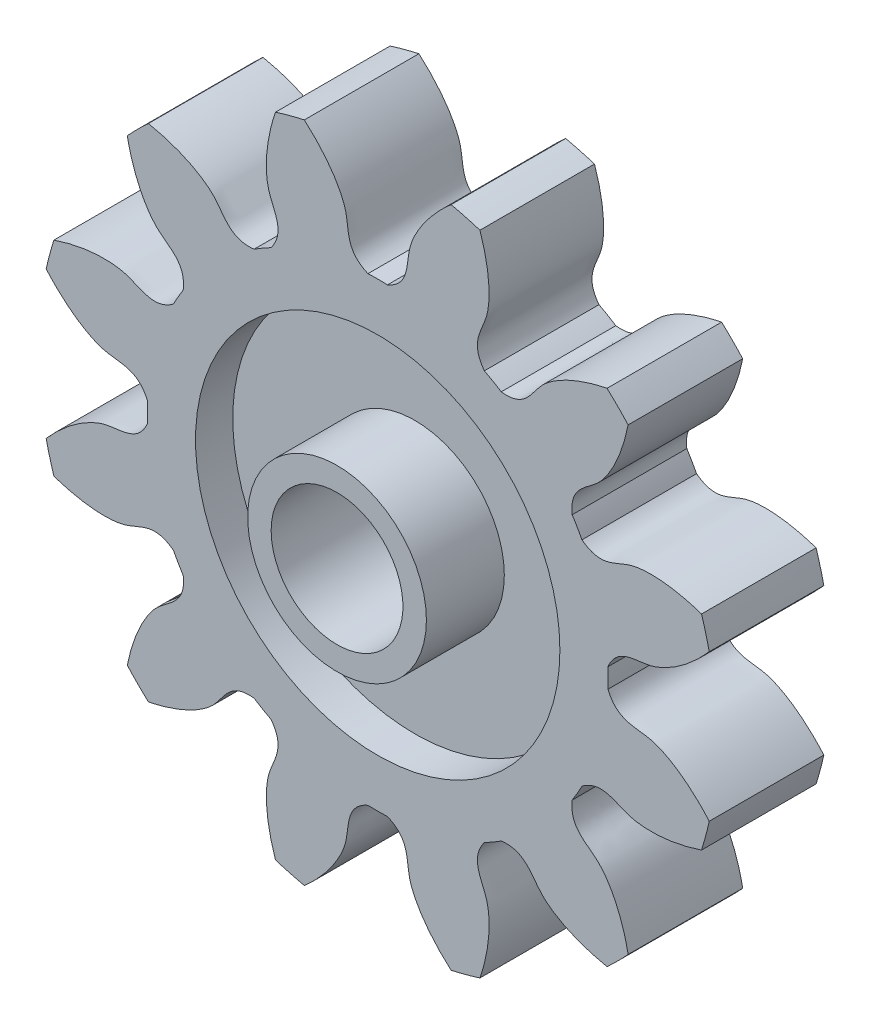
from build123d import *

# Parameters (mm, degrees)
SKETCH_1_R               = 11.853333339
EXTRUDE_1_DEPTH          = 4
CUT_EXTRUDE_1_DEPTH      = 18.233775631
PATTERN_CIRCULAR_1_COUNT = 12
SKETCH_4_R               = 6.36
CUT_EXTRUDE_2_DEPTH      = 1.3
CUT_EXTRUDE_START        = -1.3
SKETCH_5_R               = 6.36
CUT_EXTRUDE_3_DEPTH      = 1.3
SKETCH_6_R               = 3.12
EXTRUDE_2_DEPTH          = 2.72
EXTRUDE_START            = 2.72
SKETCH_7_R               = 3.12
EXTRUDE_3_DEPTH          = 2.72
SKETCH_8_R               = 2.3
CUT_EXTRUDE_4_DEPTH      = 18.738812012


with BuildPart() as part:
    # 草图1 → 凸台-拉伸1 (new body)
    with BuildSketch(Plane.XY):
        Circle(SKETCH_1_R)
    extrude(amount=EXTRUDE_1_DEPTH)

    # 草图2 → 切除-拉伸1 (cut, through all)
    with BuildSketch(Plane.XY):
        with BuildLine():
            ThreePointArc((0.340089257, 8.036140266), (0, 8.043333332), (-0.340089257, 8.036140266))
            add(Edge.make_bspline(
                [(-0.340089257, 8.036140266), (-1.152802485, 8.380827302), (-0.972605757, 9.050559634), (-1.144951038, 9.63418711), (-1.155909726, 9.668773713), (-1.168784811, 9.706751265), (-1.183712591, 9.748056173), (-1.200831778, 9.792619882), (-1.220277833, 9.840369901), (-1.242184563, 9.891229553), (-1.26668349, 9.945118118), (-1.293903901, 10.001950868), (-1.323972693, 10.061639127), (-1.357014279, 10.124090335), (-1.393150483, 10.189208114), (-1.432500435, 10.25689233), (-1.475180474, 10.327039167), (-1.521304041, 10.399541199), (-1.570981591, 10.474287463), (-1.62432049, 10.551163535), (-1.681424925, 10.630051615), (-1.74239581, 10.710830603), (-1.807330697, 10.793376185), (-1.876323688, 10.877560923), (-1.94946535, 10.963254337), (-2.026842632, 11.050323004), (-2.108538779, 11.138630643), (-2.194633261, 11.228038218), (-2.28520169, 11.318404026), (-2.380315749, 11.409583805), (-2.480043117, 11.501430831), (-2.584447403, 11.593796018), (-2.693588078, 11.686528027), (-2.807520411, 11.779473372), (-2.926295405, 11.872476524), (-3.049959741, 11.965380024), (-3.178555721, 12.058024596), (-3.312121213, 12.150249252), (-3.450689601, 12.241891415), (-3.594289737, 12.332787027), (-3.742945897, 12.422770671), (-3.896677735, 12.511675685), (-4.055500247, 12.599334283), (-4.219423733, 12.685577674), (-4.388453763, 12.770236183), (-4.562591149, 12.853139375), (-4.741831913, 12.934116174), (-4.926167263, 13.012994989), (-5.115583581, 13.08960384), (-5.31006237, 13.163770481), (-5.578482967, 13.260032674), (-5.783738495, 13.326705048), (-5.922611814, 13.368817405)],
                knots=[0, 0, 0, 0, 0.218015236, 0.222043642, 0.226545979, 0.231522246, 0.236972443, 0.24289657, 0.249294627, 0.256166614, 0.263512532, 0.271332379, 0.279626157, 0.288393865, 0.297635503, 0.307351072, 0.31754057, 0.328203999, 0.339341357, 0.350952646, 0.363037866, 0.375597015, 0.388630094, 0.402137104, 0.416118043, 0.430572913, 0.445501713, 0.460904444, 0.476781104, 0.493131694, 0.509956215, 0.527254666, 0.545027047, 0.563273358, 0.581993599, 0.601187771, 0.620855872, 0.640997904, 0.661613866, 0.682703758, 0.704267581, 0.726305333, 0.748817015, 0.771802628, 0.795262171, 0.819195644, 0.843603047, 0.868484381, 0.893839644, 0.919668838, 0.945971962, 1, 1, 1, 1], degree=3))
            ThreePointArc((-5.922611814, 13.368817405), (0, 14.621990614), (5.922611814, 13.368817405))
            add(Edge.make_bspline(
                [(0.340089257, 8.036140266), (1.152802485, 8.380827302), (0.972605757, 9.050559634), (1.144951038, 9.63418711), (1.155909726, 9.668773713), (1.168784811, 9.706751265), (1.183712591, 9.748056173), (1.200831778, 9.792619882), (1.220277833, 9.840369901), (1.242184563, 9.891229553), (1.26668349, 9.945118118), (1.293903901, 10.001950868), (1.323972693, 10.061639127), (1.357014279, 10.124090335), (1.393150483, 10.189208114), (1.432500435, 10.25689233), (1.475180474, 10.327039167), (1.521304041, 10.399541199), (1.570981591, 10.474287463), (1.62432049, 10.551163535), (1.681424925, 10.630051615), (1.74239581, 10.710830603), (1.807330697, 10.793376185), (1.876323688, 10.877560923), (1.94946535, 10.963254337), (2.026842632, 11.050323004), (2.108538779, 11.138630643), (2.194633261, 11.228038218), (2.28520169, 11.318404026), (2.380315749, 11.409583805), (2.480043117, 11.501430831), (2.584447403, 11.593796018), (2.693588078, 11.686528027), (2.807520411, 11.779473372), (2.926295405, 11.872476524), (3.049959741, 11.965380024), (3.178555721, 12.058024596), (3.312121213, 12.150249252), (3.450689601, 12.241891415), (3.594289737, 12.332787027), (3.742945897, 12.422770671), (3.896677735, 12.511675685), (4.055500247, 12.599334283), (4.219423733, 12.685577674), (4.388453763, 12.770236183), (4.562591149, 12.853139375), (4.741831913, 12.934116174), (4.926167263, 13.012994989), (5.115583581, 13.08960384), (5.31006237, 13.163770481), (5.578482967, 13.260032674), (5.783738495, 13.326705048), (5.922611814, 13.368817405)],
                knots=[0, 0, 0, 0, 0.218015236, 0.222043642, 0.226545979, 0.231522246, 0.236972443, 0.24289657, 0.249294627, 0.256166614, 0.263512532, 0.271332379, 0.279626157, 0.288393865, 0.297635503, 0.307351072, 0.31754057, 0.328203999, 0.339341357, 0.350952646, 0.363037866, 0.375597015, 0.388630094, 0.402137104, 0.416118043, 0.430572913, 0.445501713, 0.460904444, 0.476781104, 0.493131694, 0.509956215, 0.527254666, 0.545027047, 0.563273358, 0.581993599, 0.601187771, 0.620855872, 0.640997904, 0.661613866, 0.682703758, 0.704267581, 0.726305333, 0.748817015, 0.771802628, 0.795262171, 0.819195644, 0.843603047, 0.868484381, 0.893839644, 0.919668838, 0.945971962, 1, 1, 1, 1], degree=3))
        make_face()
    cut_extrude_1 = extrude(amount=CUT_EXTRUDE_1_DEPTH, mode=Mode.SUBTRACT)

    # 阵列(圆周)1: 切除-拉伸1 ×12 about axis
    pattern_circular_1_axis = Axis((0, 0, -0.2), (0, 0, 1))
    for i in range(1, PATTERN_CIRCULAR_1_COUNT):
        add(cut_extrude_1.rotate(pattern_circular_1_axis, i * 360 / PATTERN_CIRCULAR_1_COUNT), mode=Mode.SUBTRACT)

    # 草图4 → 切除-拉伸2 (cut)
    with BuildSketch(Plane.XY.offset(4)):
        Circle(SKETCH_4_R)
    extrude(amount=-CUT_EXTRUDE_2_DEPTH, mode=Mode.SUBTRACT)

    # 草图5 → 切除-拉伸3 (cut)
    with BuildSketch(Plane(origin=(0, 0, 0), x_dir=(-1, 0, 0), z_dir=(0, 0, -1)).offset(CUT_EXTRUDE_START)):
        Circle(SKETCH_5_R)
    extrude(amount=CUT_EXTRUDE_3_DEPTH, mode=Mode.SUBTRACT)

    # 草图6 → 凸台-拉伸2 (add)
    with BuildSketch(Plane.XY.offset(2.7)):
        Circle(SKETCH_6_R)
    extrude(amount=EXTRUDE_2_DEPTH)

    # 草图7 → 凸台-拉伸3 (add)
    with BuildSketch(Plane(origin=(0, 0, 1.3), x_dir=(-1, 0, 0), z_dir=(0, 0, -1)).offset(EXTRUDE_START)):
        Circle(SKETCH_7_R)
    extrude(amount=-EXTRUDE_3_DEPTH)

    # 草图8 → 切除-拉伸4 (cut, through all)
    with BuildSketch(Plane(origin=(0, 0, -1.42), x_dir=(-1, 0, 0), z_dir=(0, 0, -1))):
        Circle(SKETCH_8_R)
    extrude(amount=-CUT_EXTRUDE_4_DEPTH, mode=Mode.SUBTRACT)


solid = part.part
